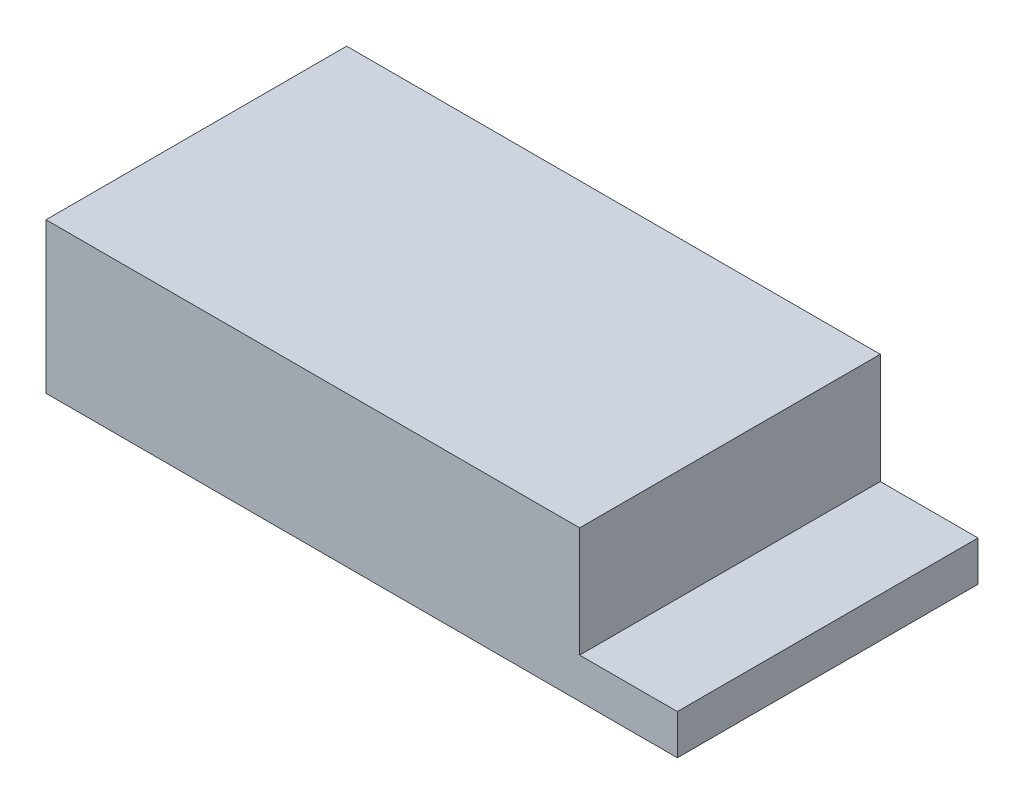
from build123d import *

# Parameters (mm, degrees)
SKETCH1_W           = 1260
SKETCH1_H           = 600
BOSS_EXTRUDE1_DEPTH = 300
SKETCH2_W           = 195
SKETCH2_H           = 600
CUT_EXTRUDE1_DEPTH  = 220


with BuildPart() as part:
    # Sketch1 → Boss-Extrude1 (new body)
    with BuildSketch(Plane(origin=(0, 0, 0), x_dir=(1, 0, 0), z_dir=(0, 1, 0))):
        Rectangle(SKETCH1_W, SKETCH1_H)
    extrude(amount=BOSS_EXTRUDE1_DEPTH)

    # Sketch2 → Cut-Extrude1 (cut)
    with BuildSketch(Plane(origin=(0, 300, 0), x_dir=(1, 0, 0), z_dir=(0, 1, 0))):
        with Locations((532.5, 0)):
            Rectangle(SKETCH2_W, SKETCH2_H)
    extrude(amount=-CUT_EXTRUDE1_DEPTH, mode=Mode.SUBTRACT)


solid = part.part
